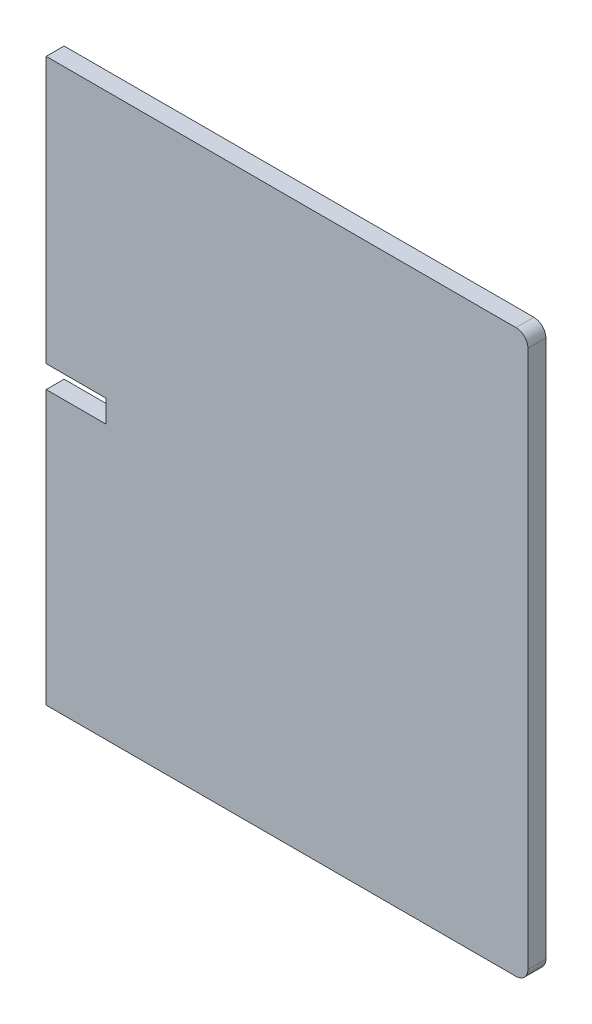
from build123d import *

# Parameters (mm, degrees)
BOSS_EXTRUDE1_DEPTH = 3.81


with BuildPart() as part:
    # Sketch1 → Boss-Extrude1 (new body)
    with BuildSketch(Plane.XY):
        with BuildLine():
            Line((66.385047378, -20.797940286), (39.917099653, -20.797940286))
            Line((39.917099653, -20.797940286), (-33.436952622, -20.797940286))
            Line((-33.436952622, -20.797940286), (-33.436952622, -68.922192769))
            Line((-33.436952622, -68.922192769), (-33.436952622, -77.344690286))
            Line((-33.436952622, -77.344690286), (-20.736952622, -77.344690286))
            Line((-20.736952622, -77.344690286), (-20.736952622, -82.107190286))
            Line((-20.736952622, -82.107190286), (-33.436952622, -82.107190286))
            Line((-33.436952622, -82.107190286), (-33.436952622, -140.177940286))
            Line((-33.436952622, -140.177940286), (2.135249773, -140.177940286))
            Line((2.135249773, -140.177940286), (66.385047378, -140.177940286))
            ThreePointArc((66.385047378, -140.177940286), (68.181098603, -139.43399151), (68.925047378, -137.637940286))
            Line((68.925047378, -137.637940286), (68.925047378, -80.487940286))
            Line((68.925047378, -80.487940286), (68.925047378, -23.337940286))
            ThreePointArc((68.925047378, -23.337940286), (68.181098603, -21.541889062), (66.385047378, -20.797940286))
        make_face()
    extrude(amount=BOSS_EXTRUDE1_DEPTH)


solid = part.part
